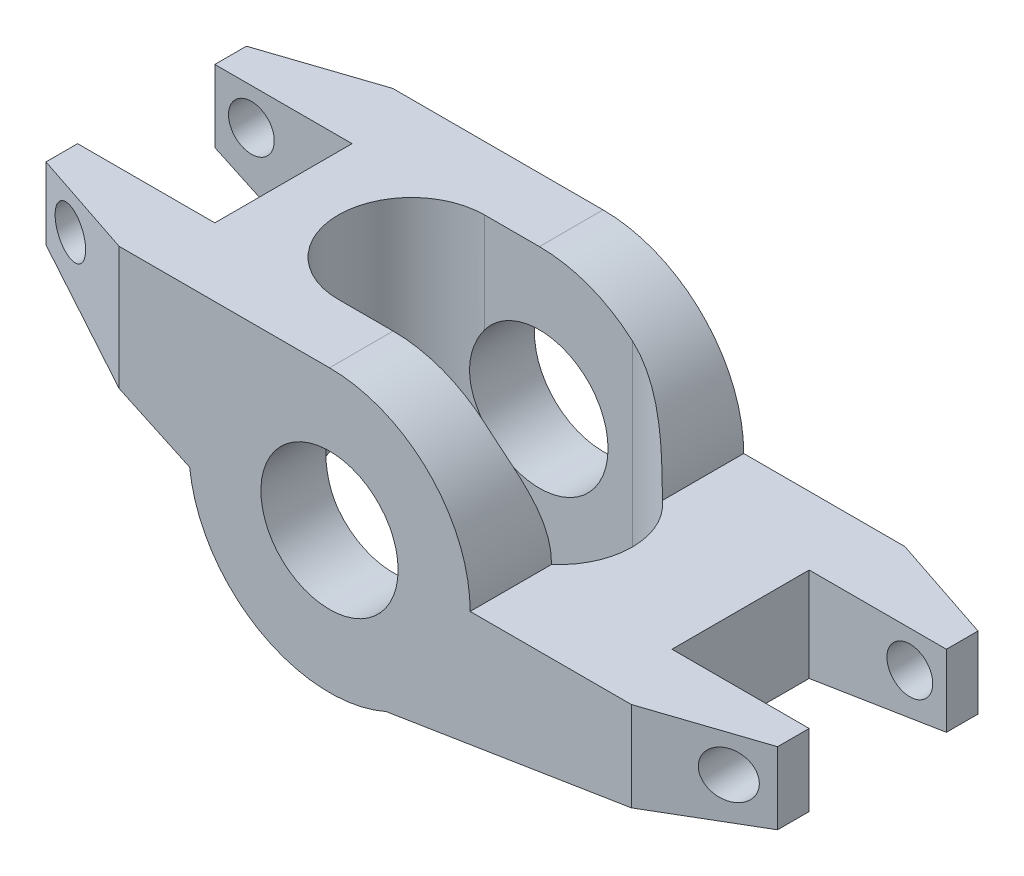
from build123d import *
from OCP.BRepFilletAPI import BRepFilletAPI_MakeChamfer

# Parameters (mm, degrees)
SKETCH1_R               = 4.765
BOSS_EXTRUDE1_DEPTH     = 9.5
CHAMFER1_SIZE           = 7.62
CHAMFER1_SIZE2          = 2.54
CHAMFER2_SIZE           = 2.54
CHAMFER2_SIZE2          = 7.62
SKETCH2_W               = 9.53
SKETCH2_H               = 9.53
CUT_EXTRUDE1_DEPTH      = 36.900947063
CUT_EXTRUDE2_DEPTH      = 32.662585176
CUT_EXTRUDE2_DEPTH_BACK = 32.662585176
CUT_EXTRUDE3_DEPTH      = 32.662585236
CUT_EXTRUDE3_DEPTH_BACK = 32.662585236
SKETCH4_R               = 1.59


with BuildPart() as part:
    # Sketch1 → Boss-Extrude1 (new, symmetric)
    with BuildSketch(Plane.XY):
        with BuildLine():
            Line((0, 9.77), (-22.23, 9.77))
            Line((-22.23, 9.77), (-22.23, 4.77))
            Line((-22.23, 4.77), (-9.711509246, -1.067468107))
            ThreePointArc((-9.711509246, -1.067468107), (-4.883625865, -8.461861403), (3.934204961, -8.942870418))
            Line((3.934204961, -8.942870418), (28.58, -5))
            Line((28.58, -5), (28.58, 0))
            Line((28.58, 0), (9.77, 0))
            ThreePointArc((9.77, 0), (6.908433252, 6.908433252), (0, 9.77))
        make_face()
        Circle(SKETCH1_R, mode=Mode.SUBTRACT)
    extrude(amount=BOSS_EXTRUDE1_DEPTH, both=True)

    # Chamfer1
    chamfer1_edges = [part.edges().sort_by_distance(p)[0] for p in [
        (-22.23, 7.27, -9.5),
        (28.58, -2.5, -9.5),
    ]]
    chamfer1_side = [part.faces().sort_by_distance(p)[0] for p in [
        (-11.115, 9.225622585, -9.5),
    ]]
    chamfer(chamfer1_edges, length=CHAMFER1_SIZE, length2=CHAMFER1_SIZE2, reference=chamfer1_side[0])

    # Chamfer2: one chamfer whose edges measure the first distance from different faces: ONE call of the kernel's chamfer builder (chamfer() names one face for all edges)
    chamfer2_edges_1 = [part.edges().sort_by_distance(p)[0] for p in [
        (-22.23, 7.27, 9.5),
    ]]
    chamfer2_side_1 = [part.faces().sort_by_distance(p)[0] for p in [
        (-22.23, 7.27, 1.27),
    ]]
    chamfer2_edges_2 = [part.edges().sort_by_distance(p)[0] for p in [
        (28.58, -2.5, 9.5),
    ]]
    chamfer2_side_2 = [part.faces().sort_by_distance(p)[0] for p in [
        (28.58, -2.5, 1.27),
    ]]
    chamfer2 = BRepFilletAPI_MakeChamfer(part.part.solid().wrapped)
    for e in chamfer2_edges_1:
        chamfer2.Add(CHAMFER2_SIZE, CHAMFER2_SIZE2, e.wrapped, chamfer2_side_1[0].wrapped)  # the first distance lies on this face
    for e in chamfer2_edges_2:
        chamfer2.Add(CHAMFER2_SIZE, CHAMFER2_SIZE2, e.wrapped, chamfer2_side_2[0].wrapped)  # the first distance lies on this face
    add(Compound.cast(chamfer2.Shape()), mode=Mode.REPLACE)

    # Sketch2 → Cut-Extrude1 (cut, through all)
    with BuildSketch(Plane(origin=(0, 9.77, 0), x_dir=(1, 0, 0), z_dir=(0, 1, 0))):
        with Locations((-17.465, 0)):
            Rectangle(SKETCH2_W, SKETCH2_H)
        with Locations((23.815, 0)):
            Rectangle(SKETCH2_W, SKETCH2_H)
    extrude(amount=-CUT_EXTRUDE1_DEPTH, mode=Mode.SUBTRACT)

    # Sketch3 → Cut-Extrude2 (cut, two sides: drawn at the far end of the back side and taken through both)
    with BuildSketch(Plane(origin=(0, 0, 0), x_dir=(1, 0, 0), z_dir=(0, 1, 0)).offset(-CUT_EXTRUDE2_DEPTH_BACK)):
        with BuildLine():
            Line((-3.81, 5.08), (6.45, 5.08))
            ThreePointArc((6.45, 5.08), (11.53, 0), (6.45, -5.08))
            Line((6.45, -5.08), (-3.81, -5.08))
            ThreePointArc((-3.81, -5.08), (-8.89, 0), (-3.81, 5.08))
        make_face()
    extrude(amount=CUT_EXTRUDE2_DEPTH + CUT_EXTRUDE2_DEPTH_BACK, mode=Mode.SUBTRACT)

    # Sketch4 → Cut-Extrude3 (cut, two sides: drawn at the far end of the back side and taken through both)
    with BuildSketch(Plane.XY.offset(-CUT_EXTRUDE3_DEPTH_BACK)):
        with Locations((-19.69, 7.23)):
            Circle(SKETCH4_R)
        with Locations((26.04, -2.54)):
            Circle(SKETCH4_R)
    extrude(amount=CUT_EXTRUDE3_DEPTH + CUT_EXTRUDE3_DEPTH_BACK, mode=Mode.SUBTRACT)


solid = part.part
